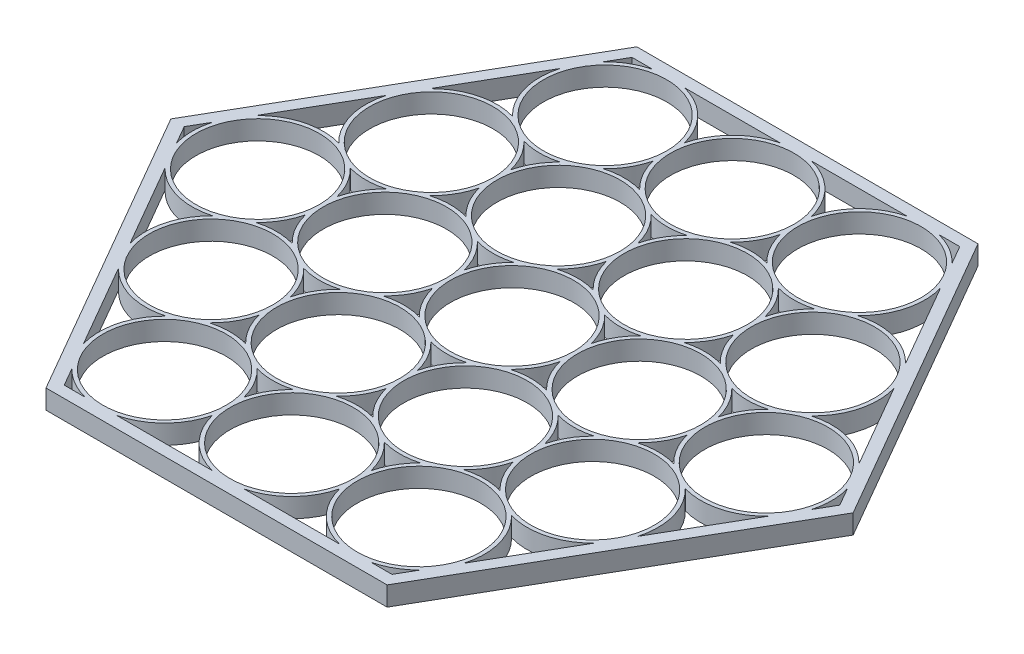
from build123d import *

# Parameters (mm, degrees)
SKETCH1_R           = 17
SKETCH1_R_2         = 16
EXTRUDE_THIN1_DEPTH = 5
EXTRUDE_THIN2_DEPTH = 5


with BuildPart() as part:
    # Sketch1 → Extrude-Thin1 (new body)
    # profile 1 of 19: a face of its own
    with BuildSketch(Plane(origin=(0, 0, 0), x_dir=(1, 0, 0), z_dir=(0, 1, 0))):
        Circle(SKETCH1_R)
        Circle(SKETCH1_R_2, mode=Mode.SUBTRACT)
    # profile 2 of 19: a face of its own
    with BuildSketch(Plane(origin=(0, 0, 0), x_dir=(1, 0, 0), z_dir=(0, 1, 0))):
        with Locations((-16.5, 28.578838325)):
            Circle(SKETCH1_R)
        with Locations((-16.5, 28.578838325)):
            Circle(SKETCH1_R_2, mode=Mode.SUBTRACT)
    # profile 3 of 19: a face of its own
    with BuildSketch(Plane(origin=(0, 0, 0), x_dir=(1, 0, 0), z_dir=(0, 1, 0))):
        with Locations((16.5, 28.578838325)):
            Circle(SKETCH1_R)
        with Locations((16.5, 28.578838325)):
            Circle(SKETCH1_R_2, mode=Mode.SUBTRACT)
    # profile 4 of 19: a face of its own
    with BuildSketch(Plane(origin=(0, 0, 0), x_dir=(1, 0, 0), z_dir=(0, 1, 0))):
        with Locations((33, 0)):
            Circle(SKETCH1_R)
        with Locations((33, 0)):
            Circle(SKETCH1_R_2, mode=Mode.SUBTRACT)
    # profile 5 of 19: a face of its own
    with BuildSketch(Plane(origin=(0, 0, 0), x_dir=(1, 0, 0), z_dir=(0, 1, 0))):
        with Locations((16.5, -28.578838325)):
            Circle(SKETCH1_R)
        with Locations((16.5, -28.578838325)):
            Circle(SKETCH1_R_2, mode=Mode.SUBTRACT)
    # profile 6 of 19: a face of its own
    with BuildSketch(Plane(origin=(0, 0, 0), x_dir=(1, 0, 0), z_dir=(0, 1, 0))):
        with Locations((-16.5, -28.578838325)):
            Circle(SKETCH1_R)
        with Locations((-16.5, -28.578838325)):
            Circle(SKETCH1_R_2, mode=Mode.SUBTRACT)
    # profile 7 of 19: a face of its own
    with BuildSketch(Plane(origin=(0, 0, 0), x_dir=(1, 0, 0), z_dir=(0, 1, 0))):
        with Locations((-33, 0)):
            Circle(SKETCH1_R)
        with Locations((-33, 0)):
            Circle(SKETCH1_R_2, mode=Mode.SUBTRACT)
    # profile 8 of 19: a face of its own
    with BuildSketch(Plane(origin=(0, 0, 0), x_dir=(1, 0, 0), z_dir=(0, 1, 0))):
        with Locations((-49.5, 28.578838325)):
            Circle(SKETCH1_R)
        with Locations((-49.5, 28.578838325)):
            Circle(SKETCH1_R_2, mode=Mode.SUBTRACT)
    # profile 9 of 19: a face of its own
    with BuildSketch(Plane(origin=(0, 0, 0), x_dir=(1, 0, 0), z_dir=(0, 1, 0))):
        with Locations((0, 57.15767665)):
            Circle(SKETCH1_R)
        with Locations((0, 57.15767665)):
            Circle(SKETCH1_R_2, mode=Mode.SUBTRACT)
    # profile 10 of 19: a face of its own
    with BuildSketch(Plane(origin=(0, 0, 0), x_dir=(1, 0, 0), z_dir=(0, 1, 0))):
        with Locations((49.5, 28.578838325)):
            Circle(SKETCH1_R)
        with Locations((49.5, 28.578838325)):
            Circle(SKETCH1_R_2, mode=Mode.SUBTRACT)
    # profile 11 of 19: a face of its own
    with BuildSketch(Plane(origin=(0, 0, 0), x_dir=(1, 0, 0), z_dir=(0, 1, 0))):
        with Locations((49.5, -28.578838325)):
            Circle(SKETCH1_R)
        with Locations((49.5, -28.578838325)):
            Circle(SKETCH1_R_2, mode=Mode.SUBTRACT)
    # profile 12 of 19: a face of its own
    with BuildSketch(Plane(origin=(0, 0, 0), x_dir=(1, 0, 0), z_dir=(0, 1, 0))):
        with Locations((0, -57.15767665)):
            Circle(SKETCH1_R)
        with Locations((0, -57.15767665)):
            Circle(SKETCH1_R_2, mode=Mode.SUBTRACT)
    # profile 13 of 19: a face of its own
    with BuildSketch(Plane(origin=(0, 0, 0), x_dir=(1, 0, 0), z_dir=(0, 1, 0))):
        with Locations((-49.5, -28.578838325)):
            Circle(SKETCH1_R)
        with Locations((-49.5, -28.578838325)):
            Circle(SKETCH1_R_2, mode=Mode.SUBTRACT)
    # profile 14 of 19: a face of its own
    with BuildSketch(Plane(origin=(0, 0, 0), x_dir=(1, 0, 0), z_dir=(0, 1, 0))):
        with Locations((-66, 0)):
            Circle(SKETCH1_R)
        with Locations((-66, 0)):
            Circle(SKETCH1_R_2, mode=Mode.SUBTRACT)
    # profile 15 of 19: a face of its own
    with BuildSketch(Plane(origin=(0, 0, 0), x_dir=(1, 0, 0), z_dir=(0, 1, 0))):
        with Locations((-33, 57.15767665)):
            Circle(SKETCH1_R)
        with Locations((-33, 57.15767665)):
            Circle(SKETCH1_R_2, mode=Mode.SUBTRACT)
    # profile 16 of 19: a face of its own
    with BuildSketch(Plane(origin=(0, 0, 0), x_dir=(1, 0, 0), z_dir=(0, 1, 0))):
        with Locations((33, 57.15767665)):
            Circle(SKETCH1_R)
        with Locations((33, 57.15767665)):
            Circle(SKETCH1_R_2, mode=Mode.SUBTRACT)
    # profile 17 of 19: a face of its own
    with BuildSketch(Plane(origin=(0, 0, 0), x_dir=(1, 0, 0), z_dir=(0, 1, 0))):
        with Locations((66, 0)):
            Circle(SKETCH1_R)
        with Locations((66, 0)):
            Circle(SKETCH1_R_2, mode=Mode.SUBTRACT)
    # profile 18 of 19: a face of its own
    with BuildSketch(Plane(origin=(0, 0, 0), x_dir=(1, 0, 0), z_dir=(0, 1, 0))):
        with Locations((33, -57.15767665)):
            Circle(SKETCH1_R)
        with Locations((33, -57.15767665)):
            Circle(SKETCH1_R_2, mode=Mode.SUBTRACT)
    # profile 19 of 19: a face of its own
    with BuildSketch(Plane(origin=(0, 0, 0), x_dir=(1, 0, 0), z_dir=(0, 1, 0))):
        with Locations((-33, -57.15767665)):
            Circle(SKETCH1_R)
        with Locations((-33, -57.15767665)):
            Circle(SKETCH1_R_2, mode=Mode.SUBTRACT)
    extrude(amount=EXTRUDE_THIN1_DEPTH)

    # Sketch1<3> → Extrude-Thin2 (add)
    with BuildSketch(Plane(origin=(0, 0, 0), x_dir=(1, 0, 0), z_dir=(0, 1, 0))):
        Polygon((-44.258330249, -76.65767665), (44.258330249, -76.65767665), (88.516660498, 0), (44.258330249, 76.65767665), (-44.258330249, 76.65767665), (-88.516660498, 0), align=None)
        Polygon((-42.526279442, -73.65767665), (42.526279442, -73.65767665), (85.052558883, 0), (42.526279442, 73.65767665), (-42.526279442, 73.65767665), (-85.052558883, 0), align=None, mode=Mode.SUBTRACT)
    extrude(amount=EXTRUDE_THIN2_DEPTH)


solid = part.part
